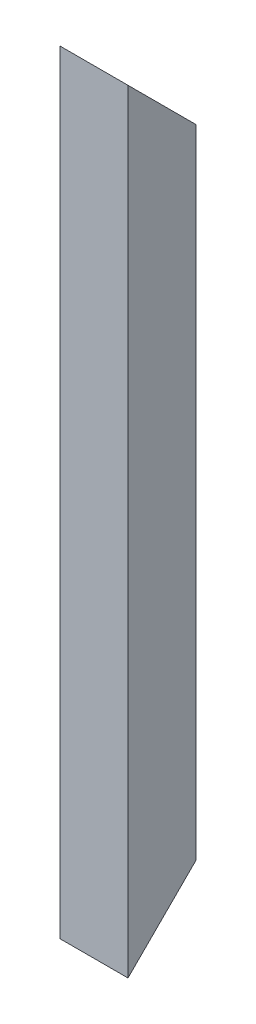
from build123d import *

# Parameters (mm, degrees)
EXTRUDE_1_DEPTH     = 250
CUT_EXTRUDE_1_DEPTH = 250


with BuildPart() as part:
    # Эскиз1 → Бобышка-Вытянуть1 (new body)
    with BuildSketch(Plane(origin=(0, 0, 0), x_dir=(1, 0, 0), z_dir=(0, 1, 0))):
        Polygon((0, 0), (0, 2), (20, 2), (20, 22), (22, 22), (22, 0), align=None)
    extrude(amount=EXTRUDE_1_DEPTH)

    # Эскиз3 → Вырез-Вытянуть1 (cut)
    with BuildSketch(Plane(origin=(22, 0, 0), x_dir=(0, 0, -1), z_dir=(1, 0, 0))):
        Polygon((0, 0), (22, 0), (22, 22), align=None)
        Polygon((22, 250), (22, 228), (0, 250), align=None)
    extrude(amount=-CUT_EXTRUDE_1_DEPTH, mode=Mode.SUBTRACT)


solid = part.part
